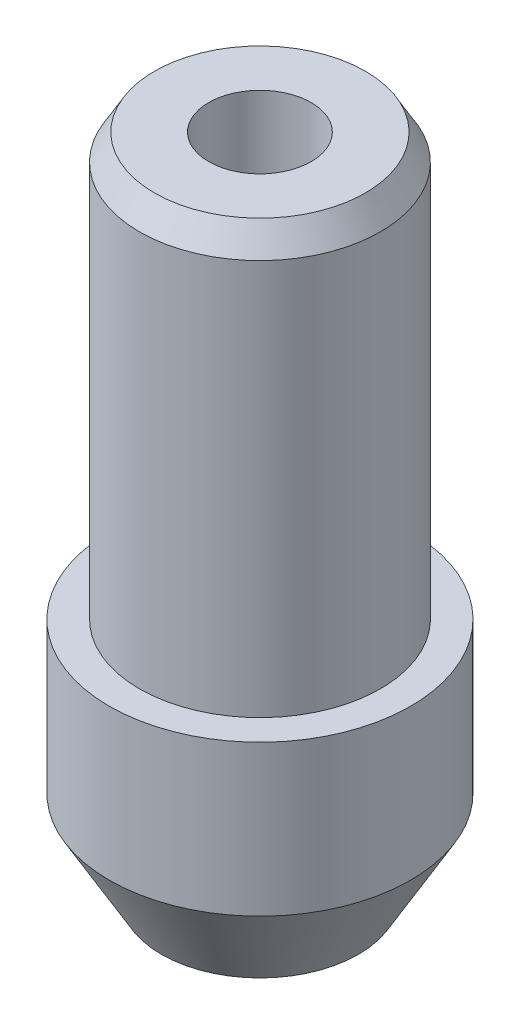
from build123d import *


with BuildPart() as part:
    # 草图1 → Revolve 480 (revolve)
    with BuildSketch(Plane.XY, mode=Mode.PRIVATE) as revolve_480_sk:
        Polygon((3.4, 41.02029906), (7, 41.02029906), (8, 39.288248252), (8, 13.02029906), (10, 13.02029906), (10, 3.02029906), (6.535898385, -2.97970094), (0, -2.97970094), (0, 24.057308144), (3.4, 26.02029906), align=None)
    revolve(revolve_480_sk.sketch.rotate(Axis((0, 50.404669261, 0), (0, -1, 0)), 90), axis=Axis((0, 50.404669261, 0), (0, -1, 0)))


solid = part.part
